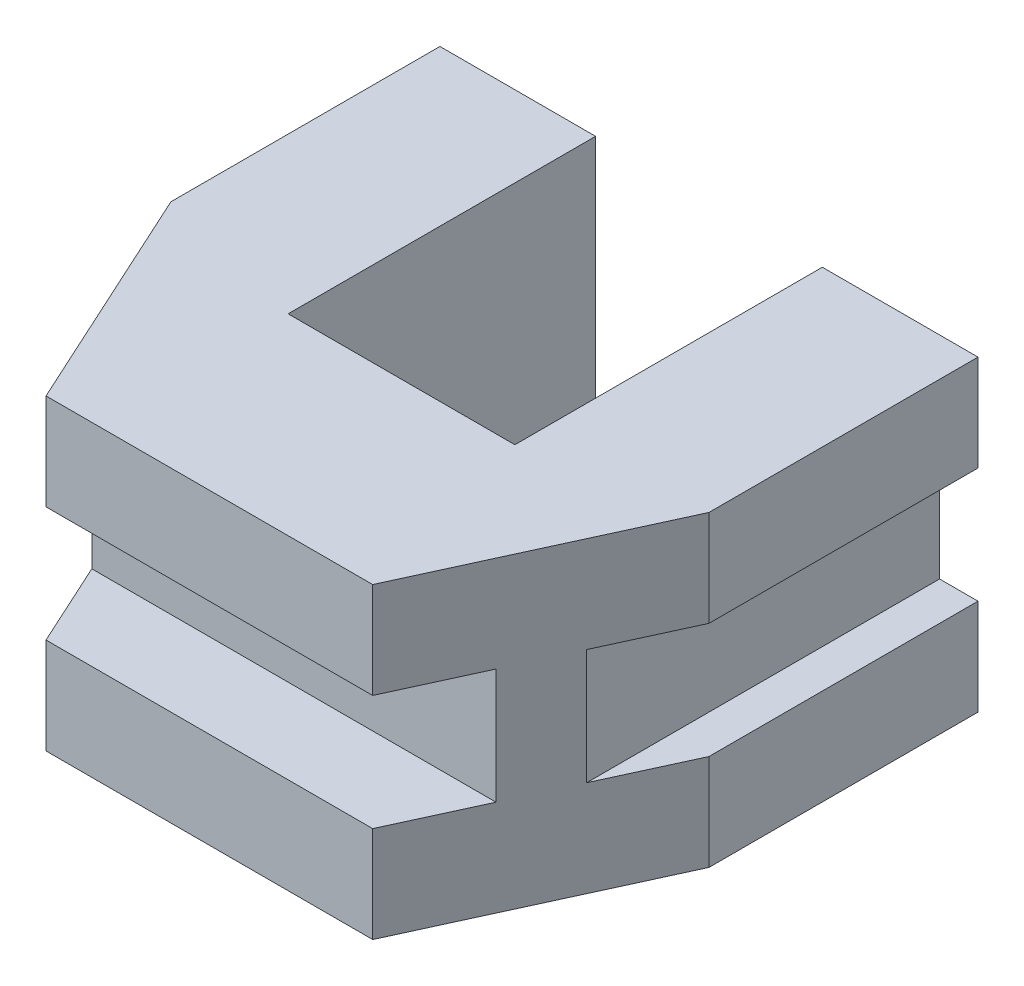
from build123d import *

# Parameters (mm, degrees)
BOSS_EXTRUDE1_DEPTH     = 4
CUT_EXTRUDE1_DEPTH      = 16.297058541
CUT_EXTRUDE1_DEPTH_BACK = 16.297058541
SKETCH2_W               = 2.2
SKETCH2_H               = 3
SKETCH3_W               = 1
SKETCH3_H               = 3
CUT_EXTRUDE2_DEPTH      = 16.297058541


with BuildPart() as part:
    # Sketch1 → Boss-Extrude1 (new, symmetric)
    with BuildSketch(Plane(origin=(0, 0, 0), x_dir=(1, 0, 0), z_dir=(0, 1, 0))):
        Polygon((-7, 13), (-7, 6), (-4.25, 0), (4.25, 0), (7, 6), (7, 13), (2.95, 13), (2.95, 5), (-2.95, 5), (-2.95, 13), align=None)
    extrude(amount=BOSS_EXTRUDE1_DEPTH, both=True)

    # Sketch2 → Cut-Extrude1 (cut, two sides: drawn at the far end of the back side and taken through both)
    with BuildSketch(Plane(origin=(0, 0, 0), x_dir=(0, 0, -1), z_dir=(1, 0, 0)).offset(-CUT_EXTRUDE1_DEPTH_BACK)):
        with Locations((1.1, 0)):
            Rectangle(SKETCH2_W, SKETCH2_H)
    extrude(amount=CUT_EXTRUDE1_DEPTH + CUT_EXTRUDE1_DEPTH_BACK, mode=Mode.SUBTRACT)

    # Sketch3 → Cut-Extrude2 (cut, through all)
    with BuildSketch(Plane.XY):
        with Locations((-6.5, 0)):
            Rectangle(SKETCH3_W, SKETCH3_H)
        with Locations((6.5, 0)):
            Rectangle(SKETCH3_W, SKETCH3_H)
    extrude(amount=-CUT_EXTRUDE2_DEPTH, mode=Mode.SUBTRACT)


solid = part.part
